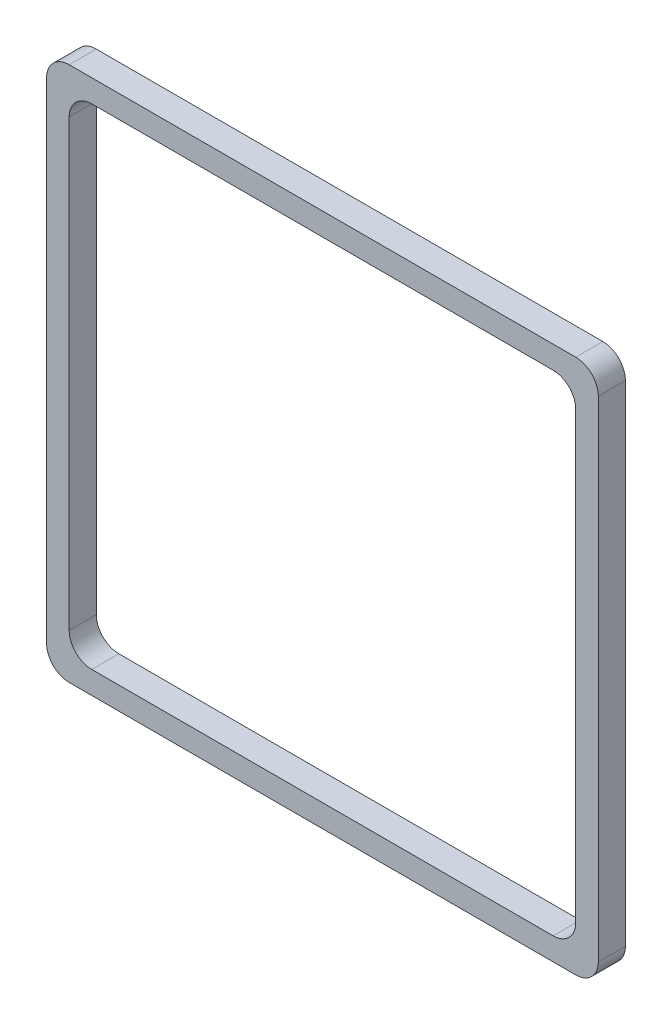
from build123d import *

# Parameters (mm, degrees)
EXTRUDE_1_DEPTH = 12


with BuildPart() as part:
    # 草图1 → 凸台-拉伸1 (new body)
    with BuildSketch(Plane.XY):
        with BuildLine():
            Line((-20.195902477, 187.840896345), (204.104097523, 187.840896345))
            ThreePointArc((204.104097523, 187.840896345), (211.175165335, 184.911964157), (214.104097523, 177.840896345))
            Line((214.104097523, 177.840896345), (214.104097523, -39.059103655))
            ThreePointArc((214.104097523, -39.059103655), (211.175165335, -46.130171467), (204.104097523, -49.059103655))
            Line((204.104097523, -49.059103655), (-20.195902477, -49.059103655))
            ThreePointArc((-20.195902477, -49.059103655), (-27.266970289, -46.130171467), (-30.195902477, -39.059103655))
            Line((-30.195902477, -39.059103655), (-30.195902477, 177.840896345))
            ThreePointArc((-30.195902477, 177.840896345), (-27.266970289, 184.911964157), (-20.195902477, 187.840896345))
        make_face()
        with BuildLine():
            Line((-10.195902477, 177.840896345), (194.104097523, 177.840896345))
            ThreePointArc((194.104097523, 177.840896345), (201.175165335, 174.911964157), (204.104097523, 167.840896345))
            Line((204.104097523, 167.840896345), (204.104097523, -29.059103655))
            ThreePointArc((204.104097523, -29.059103655), (201.175165335, -36.130171467), (194.104097523, -39.059103655))
            Line((194.104097523, -39.059103655), (-10.195902477, -39.059103655))
            ThreePointArc((-10.195902477, -39.059103655), (-17.266970289, -36.130171467), (-20.195902477, -29.059103655))
            Line((-20.195902477, -29.059103655), (-20.195902477, 167.840896345))
            ThreePointArc((-20.195902477, 167.840896345), (-17.266970289, 174.911964157), (-10.195902477, 177.840896345))
        make_face(mode=Mode.SUBTRACT)
    extrude(amount=EXTRUDE_1_DEPTH)


solid = part.part
